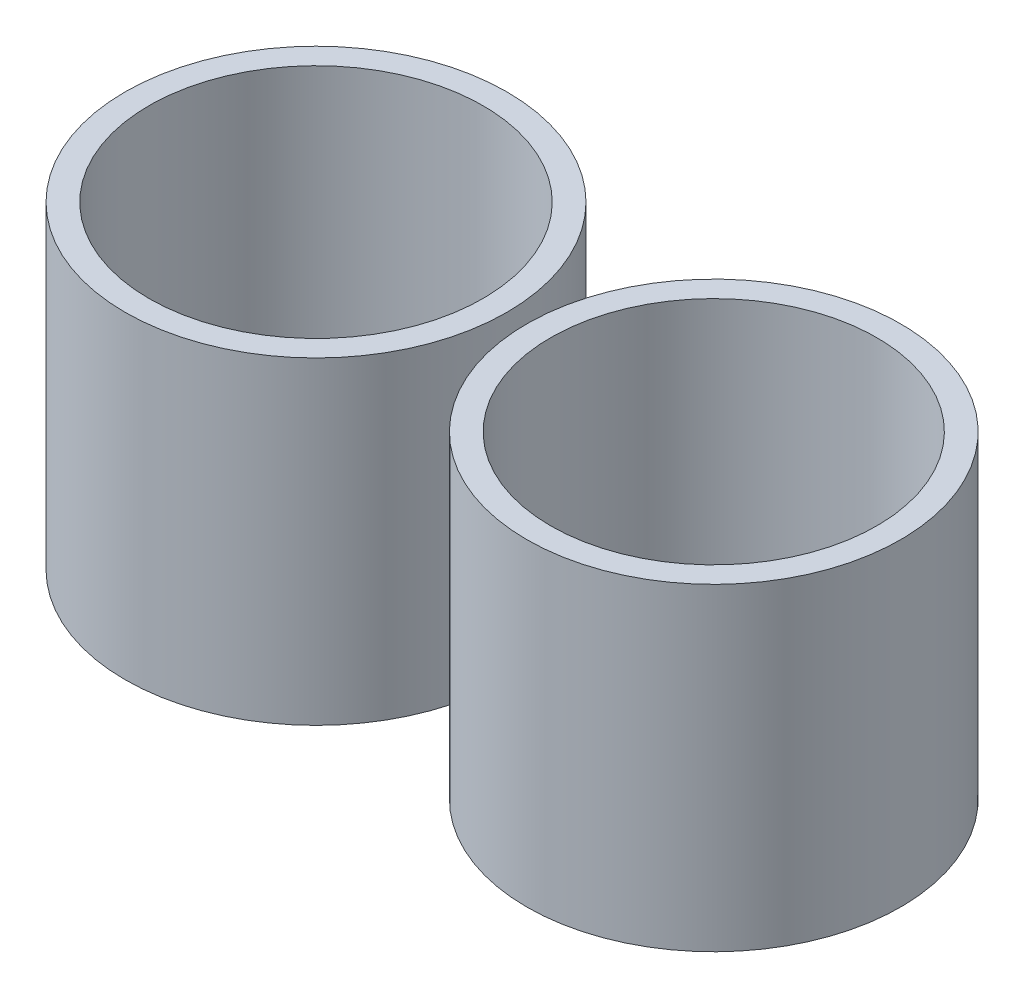
from build123d import *

# Parameters (mm, degrees)
SKETCH2_R               = 11.75
BOSS_EXTRUDE1_DEPTH     = 20
CUT_EXTRUDE1_DEPTH      = 27.002403735
CUT_EXTRUDE1_DEPTH_BACK = 27.002403735
SKETCH3_R               = 10.25
SKETCH4_R               = 12
BOSS_EXTRUDE2_DEPTH     = 20
CUT_EXTRUDE2_DEPTH      = 44.737855457
CUT_EXTRUDE2_DEPTH_BACK = 44.737855457
SKETCH5_R               = 10.5


with BuildPart() as part:
    # Sketch2 → Boss-Extrude1 (new body)
    with BuildSketch(Plane(origin=(0, 0, 0), x_dir=(1, 0, 0), z_dir=(0, 1, 0))):
        with Locations(Location((0, 0, 0), (0, 0, 270))):
            Circle(SKETCH2_R)
    extrude(amount=BOSS_EXTRUDE1_DEPTH)

    # Sketch3 → Cut-Extrude1 (cut, two sides: drawn at the far end of the back side and taken through both)
    with BuildSketch(Plane(origin=(0, 20, 0), x_dir=(1, 0, 0), z_dir=(0, 1, 0)).offset(-CUT_EXTRUDE1_DEPTH_BACK)):
        with Locations(Location((0, 0, 0), (0, 0, 270))):
            Circle(SKETCH3_R)
    extrude(amount=CUT_EXTRUDE1_DEPTH + CUT_EXTRUDE1_DEPTH_BACK, mode=Mode.SUBTRACT)


with BuildPart() as body_2:
    # Sketch4 → Boss-Extrude2 (new body)
    with BuildSketch(Plane(origin=(0, 0, 0), x_dir=(1, 0, 0), z_dir=(0, 1, 0))):
        with Locations(Location((-25, 0, 0), (0, 0, 270))):
            Circle(SKETCH4_R)
    extrude(amount=BOSS_EXTRUDE2_DEPTH)

    # Sketch5 → Cut-Extrude2 (cut, two sides: drawn at the far end of the back side and taken through both)
    with BuildSketch(Plane(origin=(0, 20, 0), x_dir=(1, 0, 0), z_dir=(0, 1, 0)).offset(-CUT_EXTRUDE2_DEPTH_BACK)):
        with Locations(Location((-25, 0, 0), (0, 0, 270))):
            Circle(SKETCH5_R)
    extrude(amount=CUT_EXTRUDE2_DEPTH + CUT_EXTRUDE2_DEPTH_BACK, mode=Mode.SUBTRACT)


solid = Compound([part.part, body_2.part])
